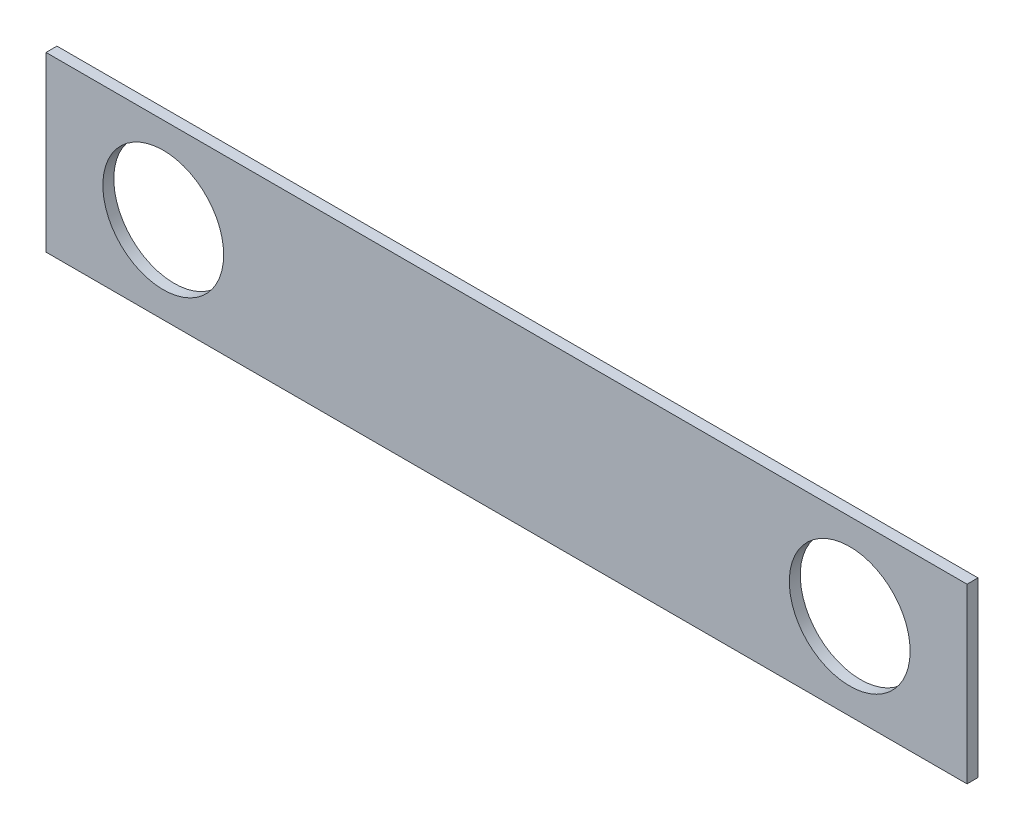
from build123d import *

# Parameters (mm, degrees)
SKETCH1_W           = 63.9
SKETCH1_H           = 12
BOSS_EXTRUDE1_DEPTH = 0.76
SKETCH3_R           = 4.191
CUT_EXTRUDE1_DEPTH  = 66.021439541


with BuildPart() as part:
    # Sketch1 → Boss-Extrude1 (new body)
    with BuildSketch(Plane.XY):
        with Locations((31.95, 6)):
            Rectangle(SKETCH1_W, SKETCH1_H)
    extrude(amount=BOSS_EXTRUDE1_DEPTH)

    # Sketch3 → Cut-Extrude1 (cut, through all)
    with BuildSketch(Plane.XY.offset(0.76)):
        with Locations((8.135, 6)):
            Circle(SKETCH3_R)
        with Locations((55.76, 6)):
            Circle(SKETCH3_R)
    extrude(amount=-CUT_EXTRUDE1_DEPTH, mode=Mode.SUBTRACT)


solid = part.part
